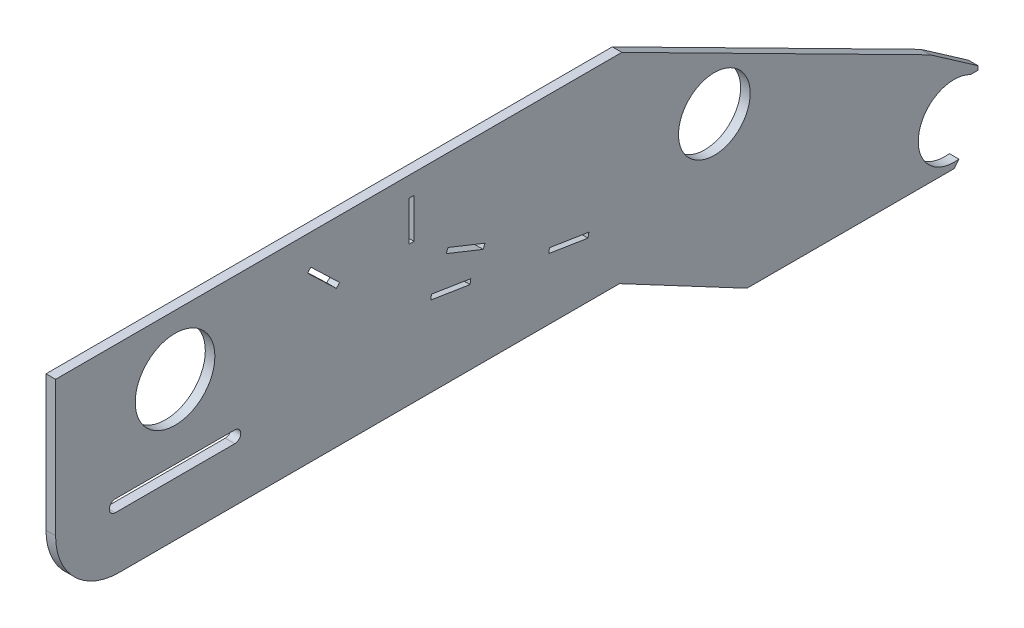
from build123d import *

# Parameters (mm, degrees)
SKETCH_1_R          = 50
SKETCH_1_R_2        = 45
EXTRUDE_1_DEPTH     = 12
FILLET_1_R          = 80
CUT_EXTRUDE_1_DEPTH = 12
SKETCH_4_W          = 6
SKETCH_4_H          = 50
CUT_EXTRUDE_2_DEPTH = 12


with BuildPart() as part:
    # 草图1 → 凸台-拉伸1 (new body)
    with BuildSketch(Plane(origin=(0, 0, 0), x_dir=(0, 0, -1), z_dir=(1, 0, 0))):
        with BuildLine():
            Line((-150, 75), (560.88072706, 75))
            Line((560.88072706, 75), (948, -121.211138337))
            Line((948, -121.211138337), (1008, -163))
            Line((1008, -163), (1008, -168))
            Line((1008, -168), (998.615528128, -168))
            ThreePointArc((998.615528128, -168), (933.656897839, -200.339106398), (984, -252.598206242))
            Line((984, -252.598206242), (978, -260))
            Line((978, -260), (718, -260))
            Line((718, -260), (558, -175))
            Line((558, -175), (-150, -175))
            Line((-150, -175), (-150, 75))
        make_face()
        Circle(SKETCH_1_R, mode=Mode.SUBTRACT)
        with Locations((677, -50)):
            Circle(SKETCH_1_R_2, mode=Mode.SUBTRACT)
    extrude(amount=EXTRUDE_1_DEPTH)

    # 圆角1
    fillet_1_edges = [part.edges().sort_by_distance(p)[0] for p in [
        (6, -175, 150),
    ]]
    fillet(fillet_1_edges, radius=FILLET_1_R)

    # 草图3 → 切除-拉伸1 (cut)
    with BuildSketch(Plane(origin=(12, 0, 0), x_dir=(0, 0, -1), z_dir=(1, 0, 0))):
        with BuildLine():
            Line((-75, -92.5), (75, -92.5))
            ThreePointArc((75, -92.5), (82.5, -100), (75, -107.5))
            Line((75, -107.5), (-75, -107.5))
            ThreePointArc((-75, -107.5), (-82.5, -100), (-75, -92.5))
        make_face()
    extrude(amount=-CUT_EXTRUDE_1_DEPTH, mode=Mode.SUBTRACT)

    # 草图4 → 切除-拉伸2 (cut)
    with BuildSketch(Plane(origin=(12, 0, 0), x_dir=(0, 0, -1), z_dir=(1, 0, 0))):
        Polygon((170.51068381, 36.627050799), (206.580049862, 2.000459389), (202.424858893, -2.327864537), (166.355492841, 32.298726872), align=None)
        with Locations((297, 25)):
            Rectangle(SKETCH_4_W, SKETCH_4_H)
        Polygon((340.423834544, -33.569533818), (386.847669089, -52.139067635), (389.076013147, -46.56820749), (342.652178602, -27.998673672), align=None)
        Polygon((470.060094707, -91.936220159), (519.439680826, -99.788383854), (518.497421183, -105.713934188), (469.117835064, -97.861770494), align=None)
        Polygon((321.921336349, -68.379729076), (371.300922468, -76.231892771), (370.358662825, -82.157443105), (320.979076706, -74.305279411), align=None)
    extrude(amount=-CUT_EXTRUDE_2_DEPTH, mode=Mode.SUBTRACT)


solid = part.part
